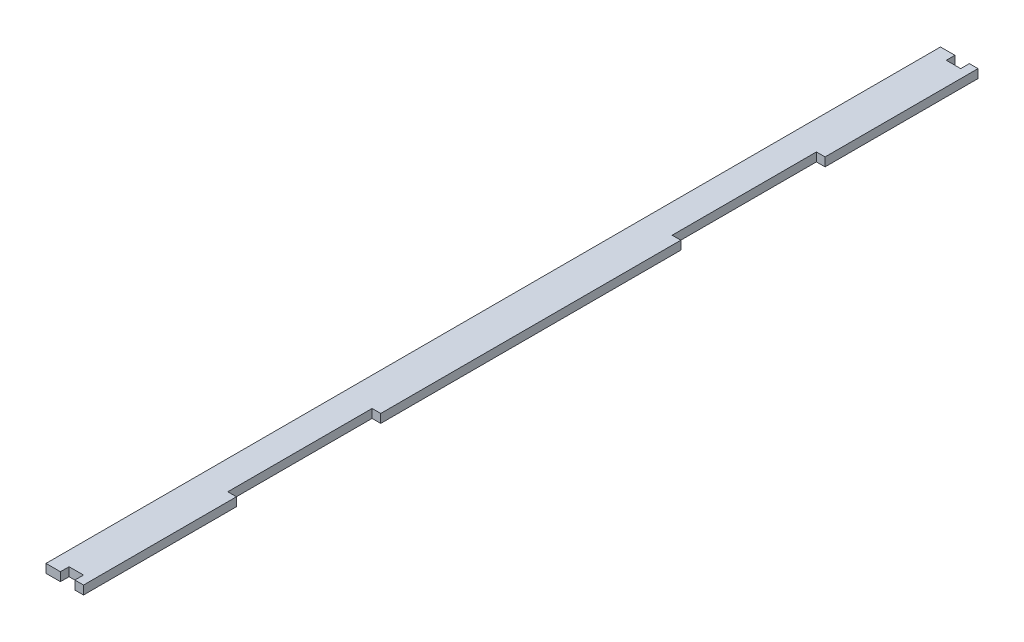
from build123d import *

# Parameters (mm, degrees)
EXTRUDE_1_DEPTH = 3


with BuildPart() as part:
    # 스케치1 → 보스-돌출1 (new body)
    with BuildSketch(Plane(origin=(0, 0, 0), x_dir=(1, 0, 0), z_dir=(0, 1, 0))):
        Polygon((6.409346895, -130.15434598), (6.409346895, -127.15434598), (11.409346895, -127.15434598), (11.409346895, -130.15434598), (14.409346895, -130.15434598), (14.409346895, -77.15434598), (11.409346895, -77.15434598), (11.409346895, -27.15434598), (14.409346895, -27.15434598), (14.409346895, 76.84565402), (11.409346895, 76.84565402), (11.409346895, 126.84565402), (14.409346895, 126.84565402), (14.409346895, 179.84565402), (11.409346895, 179.84565402), (11.409346895, 176.84565402), (6.409346895, 176.84565402), (6.409346895, 179.84565402), (1.409346895, 179.84565402), (1.409346895, -130.15434598), align=None)
    extrude(amount=EXTRUDE_1_DEPTH)


solid = part.part
